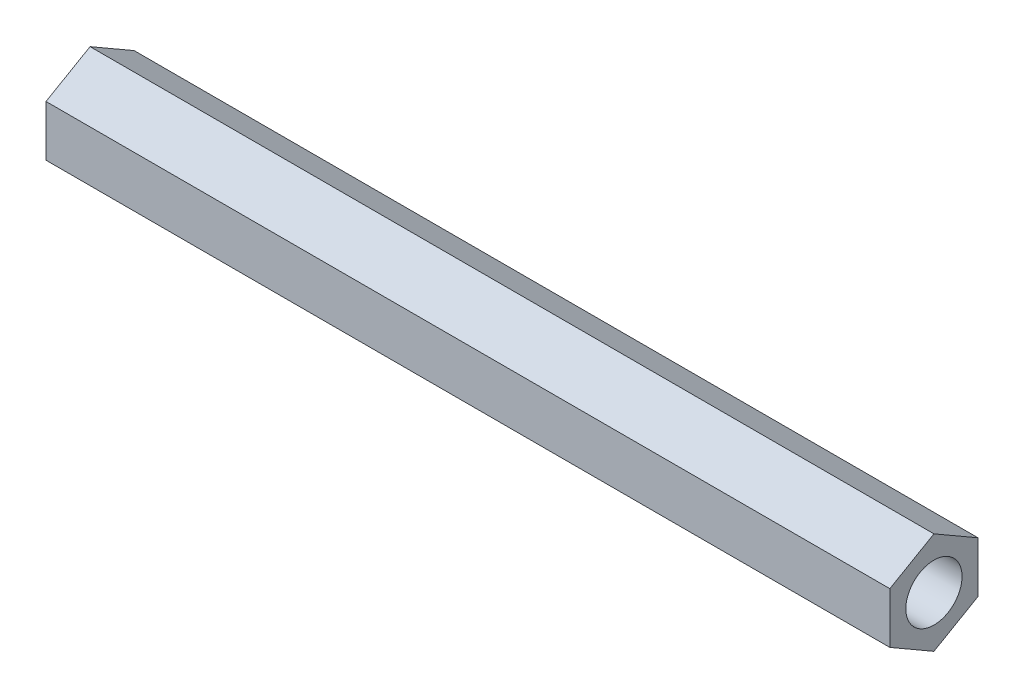
from build123d import *

# Parameters (mm, degrees)
SKETCH_1_R      = 1.5
EXTRUDE_1_DEPTH = 45


with BuildPart() as part:
    # 草图1 → 凸台-拉伸1 (new body)
    with BuildSketch(Plane(origin=(0, 0, 0), x_dir=(0, 0, -1), z_dir=(1, 0, 0))):
        Polygon((2.35, 1.356773133), (0, 2.713546265), (-2.35, 1.356773133), (-2.35, -1.356773133), (0, -2.713546265), (2.35, -1.356773133), align=None)
        with Locations(Location((0, 0, 0), (0, 0, 180))):
            Circle(SKETCH_1_R, mode=Mode.SUBTRACT)
    extrude(amount=EXTRUDE_1_DEPTH)


solid = part.part
